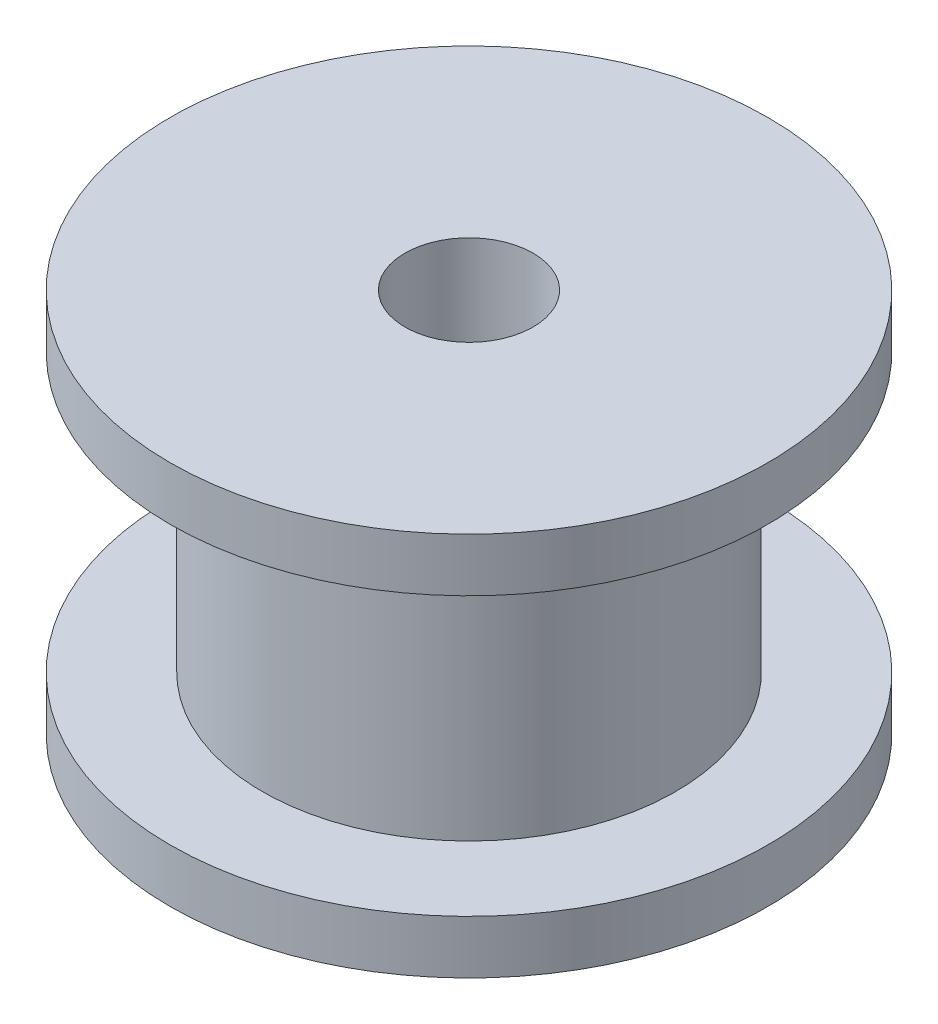
from build123d import *


with BuildPart() as part:
    # Esboço1 → Revolução1 (revolve)
    with BuildSketch(Plane.XY, mode=Mode.PRIVATE) as revolu_o1_sk:
        Polygon((1.5, 9), (7, 9), (7, 7.75), (4.84, 7.75), (4.84, 1.25), (7, 1.25), (7, 0), (1.5, 0), align=None)
    revolve(revolu_o1_sk.sketch.rotate(Axis((0, 0, 0), (0, 1, 0)), 90), axis=Axis((0, 0, 0), (0, 1, 0)))


solid = part.part
